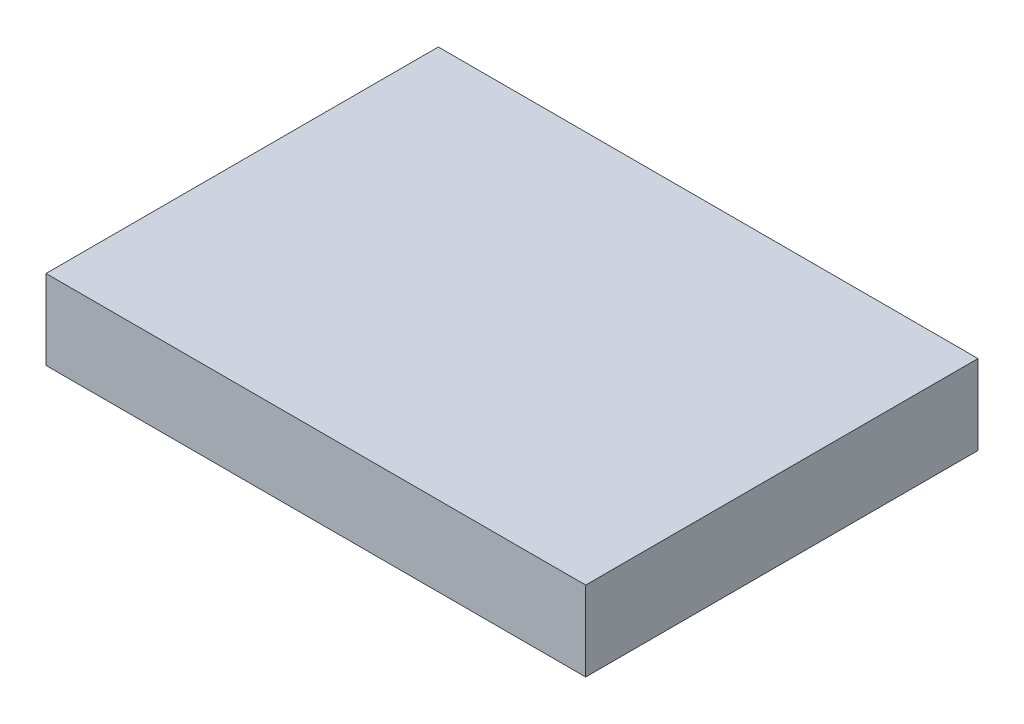
from build123d import *

# Parameters (mm, degrees)
SKETCH_1_W      = 27.1
SKETCH_1_H      = 19.7
EXTRUDE_1_DEPTH = 4


with BuildPart() as part:
    # 草图1 → 凸台-拉伸1 (new body)
    with BuildSketch(Plane(origin=(0, 0, 0), x_dir=(1, 0, 0), z_dir=(0, 1, 0))):
        with Locations((13.55, 9.85)):
            Rectangle(SKETCH_1_W, SKETCH_1_H)
    extrude(amount=EXTRUDE_1_DEPTH)


solid = part.part
